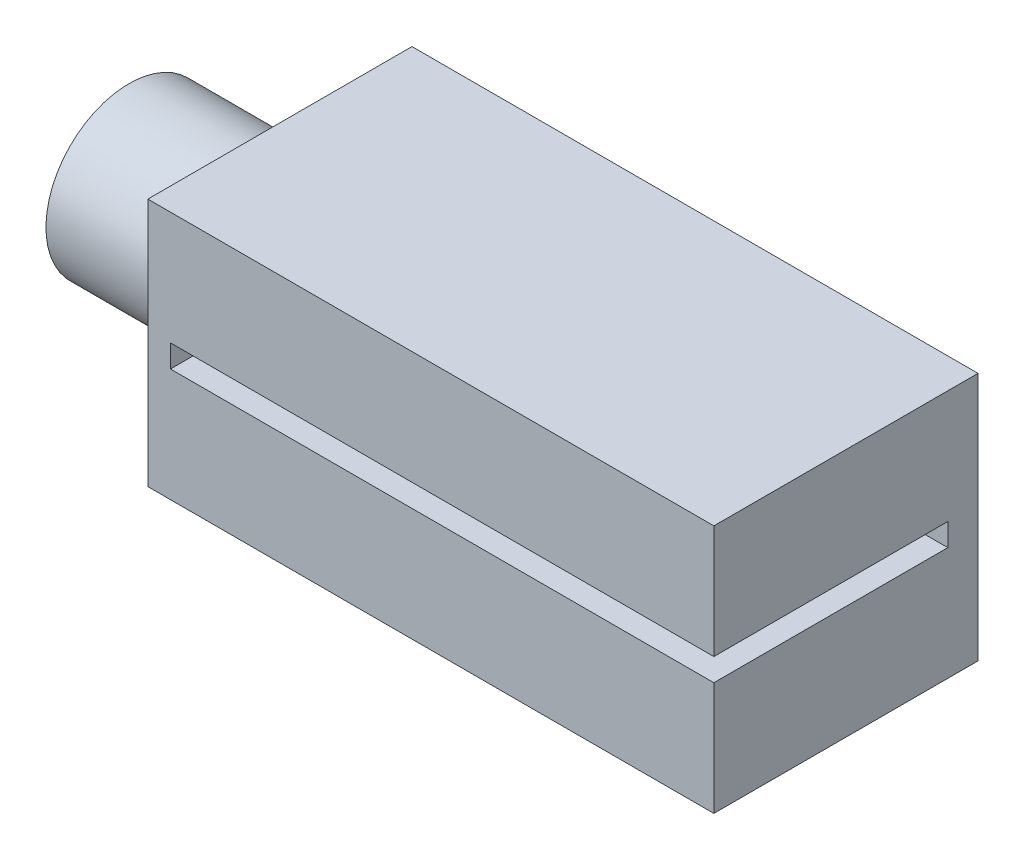
from build123d import *

# Parameters (mm, degrees)
SKETCH1_W           = 19.05
SKETCH1_H           = 8.382
BOSS_EXTRUDE2_DEPTH = 8.89
SKETCH3_W           = 18.288
SKETCH3_H           = 0.762
CUT_EXTRUDE1_DEPTH  = 7.874
SKETCH4_R           = 2.794
BOSS_EXTRUDE3_DEPTH = 5.08


with BuildPart() as part:
    # Sketch1 → Boss-Extrude2 (new body)
    with BuildSketch(Plane.XY):
        with Locations((9.525, 4.191)):
            Rectangle(SKETCH1_W, SKETCH1_H)
    extrude(amount=-BOSS_EXTRUDE2_DEPTH)

    # Sketch3 → Cut-Extrude1 (cut)
    with BuildSketch(Plane.XY):
        with Locations((9.906, 4.191)):
            Rectangle(SKETCH3_W, SKETCH3_H)
    extrude(amount=-CUT_EXTRUDE1_DEPTH, mode=Mode.SUBTRACT)

    # Sketch4 → Boss-Extrude3 (add)
    with BuildSketch(Plane.ZY):
        with Locations(Location((-4.445, 4.191, 0), (0, 0, 270))):
            Circle(SKETCH4_R)
    extrude(amount=BOSS_EXTRUDE3_DEPTH)


solid = part.part
